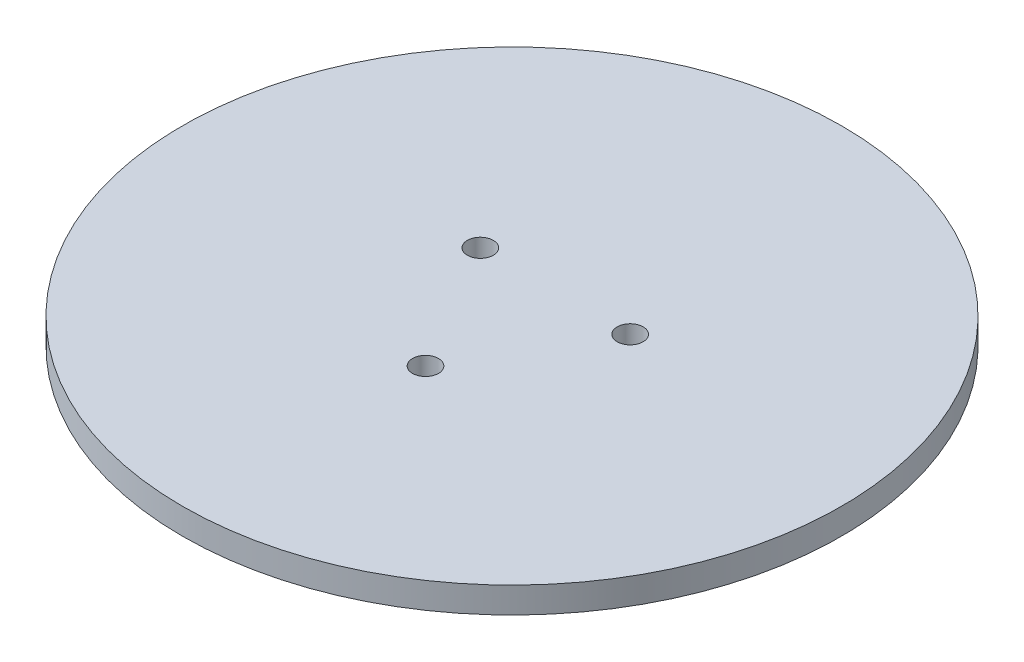
from build123d import *

# Parameters (mm, degrees)
SKETCH1_R           = 38.1
BOSS_EXTRUDE1_DEPTH = 3
SKETCH3_R           = 1.5
CUT_EXTRUDE2_DEPTH  = 54.96498865


with BuildPart() as part:
    # Sketch1 → Boss-Extrude1 (new body)
    with BuildSketch(Plane(origin=(0, 0, 0), x_dir=(1, 0, 0), z_dir=(0, 1, 0))):
        with Locations(Location((0, 0, 0), (0, 0, 270))):
            Circle(SKETCH1_R)
    extrude(amount=BOSS_EXTRUDE1_DEPTH)

    # Sketch3 → Cut-Extrude2 (cut, through all)
    with BuildSketch(Plane(origin=(0, 3, 0), x_dir=(1, 0, 0), z_dir=(0, 1, 0))):
        with Locations(Location((-8.660254038, 5, 0), (0, 0, 270))):
            Circle(SKETCH3_R)
        with Locations(Location((8.660254038, 5, 0), (0, 0, 270))):
            Circle(SKETCH3_R)
        with Locations(Location((0, -10, 0), (0, 0, 270))):
            Circle(SKETCH3_R)
    extrude(amount=-CUT_EXTRUDE2_DEPTH, mode=Mode.SUBTRACT)


solid = part.part
